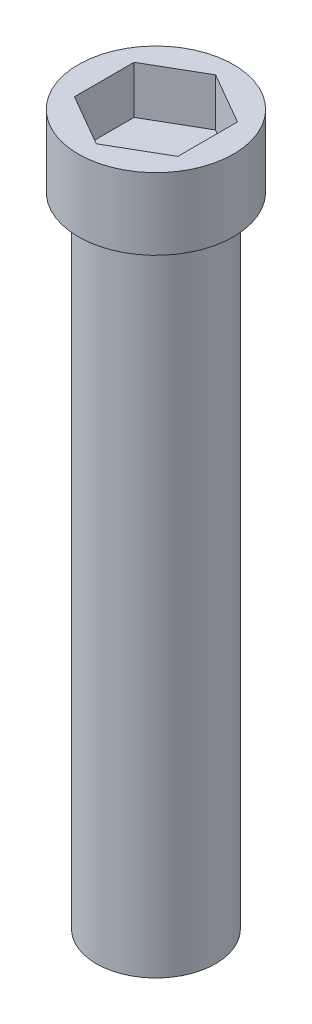
from build123d import *

# Parameters (mm, degrees)
SKETCH1_R          = 2.5
SCREW_LENGTH_DEPTH = 26.75
SKETCH2_R          = 3.25
SCREW_CAP_DEPTH    = 3
SCREW_HOLE_DEPTH   = 2


with BuildPart() as part:
    # Sketch1 → Screw Length (new body)
    with BuildSketch(Plane(origin=(0, 0, 0), x_dir=(1, 0, 0), z_dir=(0, 1, 0))):
        with Locations(Location((0, 0, 0), (0, 0, 270))):
            Circle(SKETCH1_R)
    extrude(amount=SCREW_LENGTH_DEPTH)

    # Sketch2 → Screw Cap (add)
    with BuildSketch(Plane(origin=(0, 26.75, 0), x_dir=(1, 0, 0), z_dir=(0, 1, 0))):
        with Locations(Location((0, 0, 0), (0, 0, 270))):
            Circle(SKETCH2_R)
    extrude(amount=SCREW_CAP_DEPTH)

    # Sketch3 → Screw Hole (cut)
    with BuildSketch(Plane(origin=(0, 29.75, 0), x_dir=(1, 0, 0), z_dir=(0, 1, 0))):
        Polygon((0, 2.5), (-2.165063509, 1.25), (-2.165063509, -1.25), (0, -2.5), (2.165063509, -1.25), (2.165063509, 1.25), align=None)
    extrude(amount=-SCREW_HOLE_DEPTH, mode=Mode.SUBTRACT)


solid = part.part
